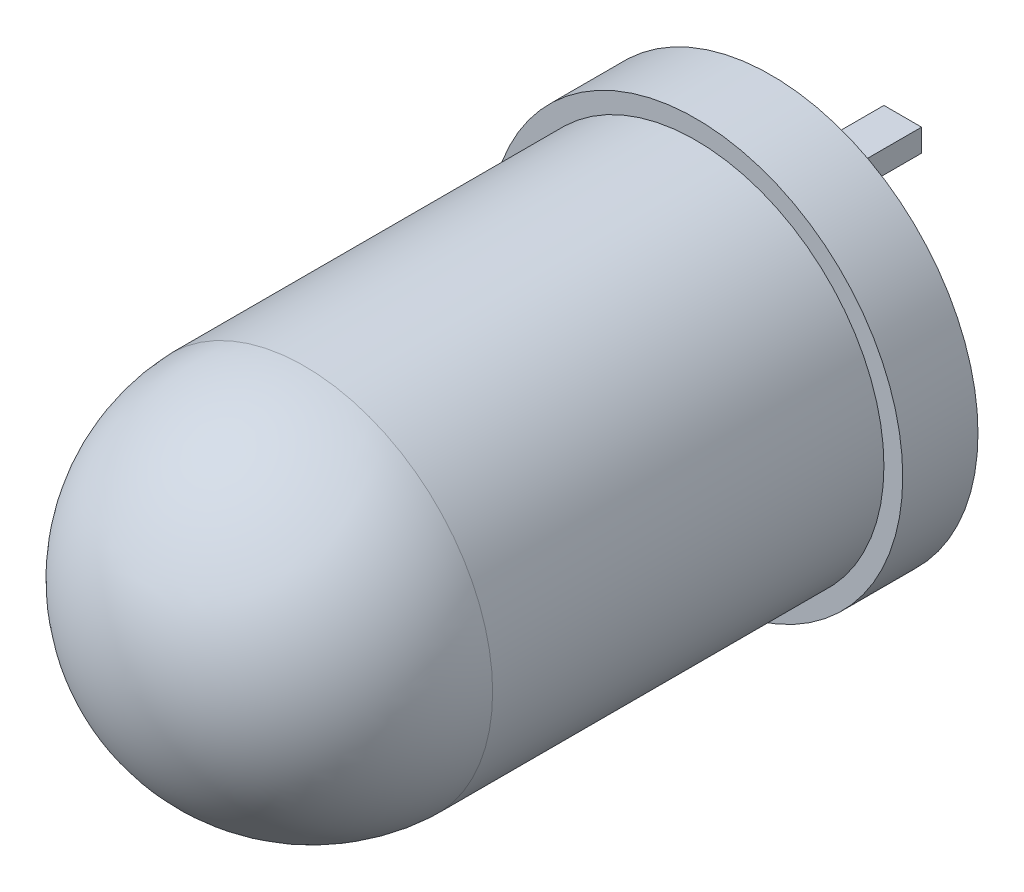
from build123d import *

# Parameters (mm, degrees)
SKETCH1_R           = 2.5
BOSS_EXTRUDE1_DEPTH = 2.6
BOSS_EXTRUDE2_START = -2.6
SKETCH2_R           = 2.75
BOSS_EXTRUDE2_DEPTH = 1
DOME1_FACE_RADIUS   = 2.5
DOME1_HEIGHT        = 2.4
BOSS_EXTRUDE3_START = -3.6
SKETCH3_W           = 0.5
SKETCH3_H           = 0.3
BOSS_EXTRUDE3_DEPTH = 3
CUT_EXTRUDE1_START  = -6.6
SKETCH4_W           = 0.5
SKETCH4_H           = 0.3
CUT_EXTRUDE1_DEPTH  = 2


with BuildPart() as part:
    # Sketch1 → Boss-Extrude1 (new, symmetric)
    with BuildSketch(Plane.XY):
        Circle(SKETCH1_R)
    extrude(amount=BOSS_EXTRUDE1_DEPTH, both=True)

    # Sketch2 → Boss-Extrude2 (add)
    with BuildSketch(Plane.XY.offset(BOSS_EXTRUDE2_START)):
        Circle(SKETCH2_R)
    extrude(amount=-BOSS_EXTRUDE2_DEPTH)

    # Dome1: a dome of height H over a round flat face of radius A is a cap of a sphere of radius (A * A + H * H) / (2 * H)
    dome1_r = (DOME1_FACE_RADIUS * DOME1_FACE_RADIUS + DOME1_HEIGHT * DOME1_HEIGHT) / (2 * DOME1_HEIGHT)
    dome1_base = Plane((0, 0, 2.6), z_dir=(0, 0, 1))
    with Locations(dome1_base.offset(DOME1_HEIGHT - dome1_r)):
        dome1_ball = Sphere(dome1_r, mode=Mode.PRIVATE)
    add(split(dome1_ball, bisect_by=dome1_base, keep=Keep.TOP, mode=Mode.PRIVATE))

    # Sketch3 → Boss-Extrude3 (add)
    with BuildSketch(Plane.XY.offset(BOSS_EXTRUDE3_START)):
        with Locations((1.25, 0)):
            Rectangle(SKETCH3_W, SKETCH3_H)
        with Locations((-1.25, 0)):
            Rectangle(SKETCH3_W, SKETCH3_H)
    extrude(amount=-BOSS_EXTRUDE3_DEPTH)

    # Sketch4 → Cut-Extrude1 (cut)
    with BuildSketch(Plane.XY.offset(CUT_EXTRUDE1_START)):
        with Locations((1.25, 0)):
            Rectangle(SKETCH4_W, SKETCH4_H)
    extrude(amount=CUT_EXTRUDE1_DEPTH, mode=Mode.SUBTRACT)


solid = part.part
